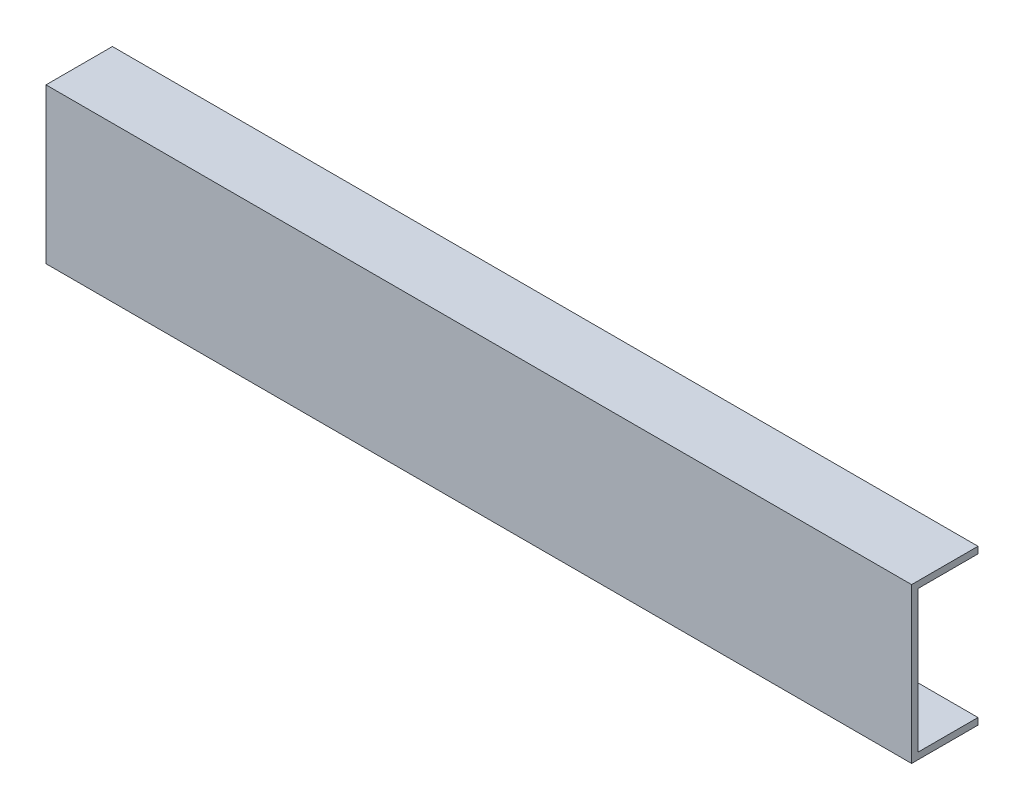
from build123d import *

# Parameters (mm, degrees)
RESSALTO_EXTRUS_O1_DEPTH = 391.08


with BuildPart() as part:
    # Esboço1 → Ressalto-extrusão1 (new body)
    with BuildSketch(Plane(origin=(0, 0, 0), x_dir=(0, 0, -1), z_dir=(1, 0, 0))):
        Polygon((0, 0), (-30, 0), (-30, 70), (0, 70), (0, 67), (-27, 67), (-27, 3), (0, 3), align=None)
    extrude(amount=RESSALTO_EXTRUS_O1_DEPTH)


solid = part.part
